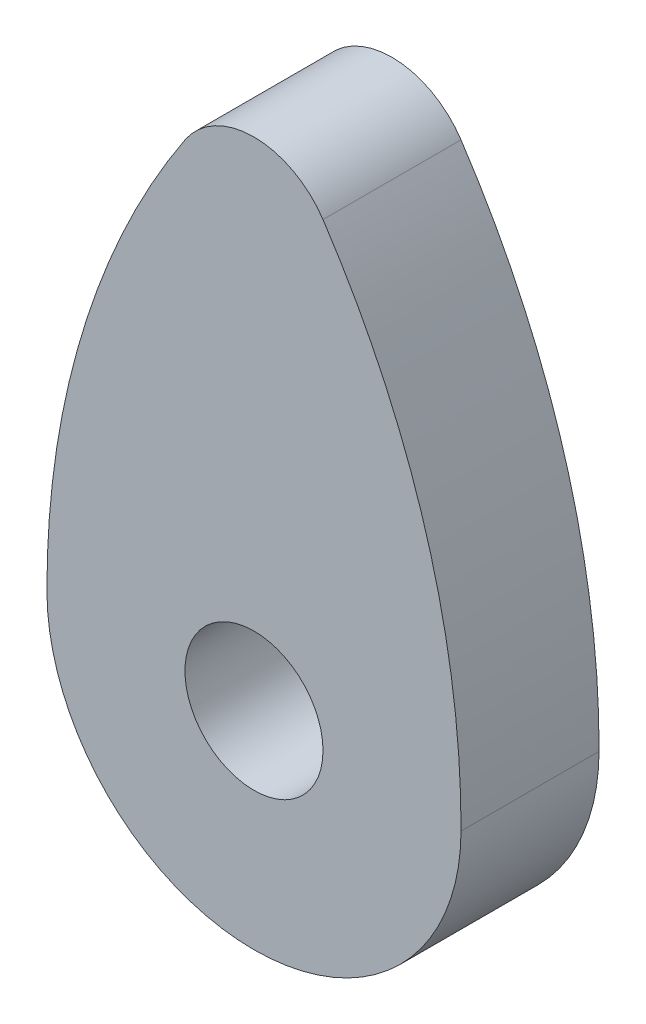
from build123d import *

# Parameters (mm, degrees)
SKETCH1_R           = 5
BOSS_EXTRUDE1_DEPTH = 5


with BuildPart() as part:
    # Sketch1 → Boss-Extrude1 (new, symmetric)
    with BuildSketch(Plane.XY):
        with BuildLine():
            ThreePointArc((-14.999916666, -0.05), (0, -15), (14.999916666, -0.05))
            ThreePointArc((14.999916666, -0.05), (12.474592102, 17.374981858), (4.999972222, 33.316666667))
            ThreePointArc((4.999972222, 33.316666667), (0, 36), (-4.999972222, 33.316666667))
            ThreePointArc((-4.999972222, 33.316666667), (-12.474592102, 17.374981858), (-14.999916666, -0.05))
        make_face()
        Circle(SKETCH1_R, mode=Mode.SUBTRACT)
    extrude(amount=BOSS_EXTRUDE1_DEPTH, both=True)


solid = part.part
